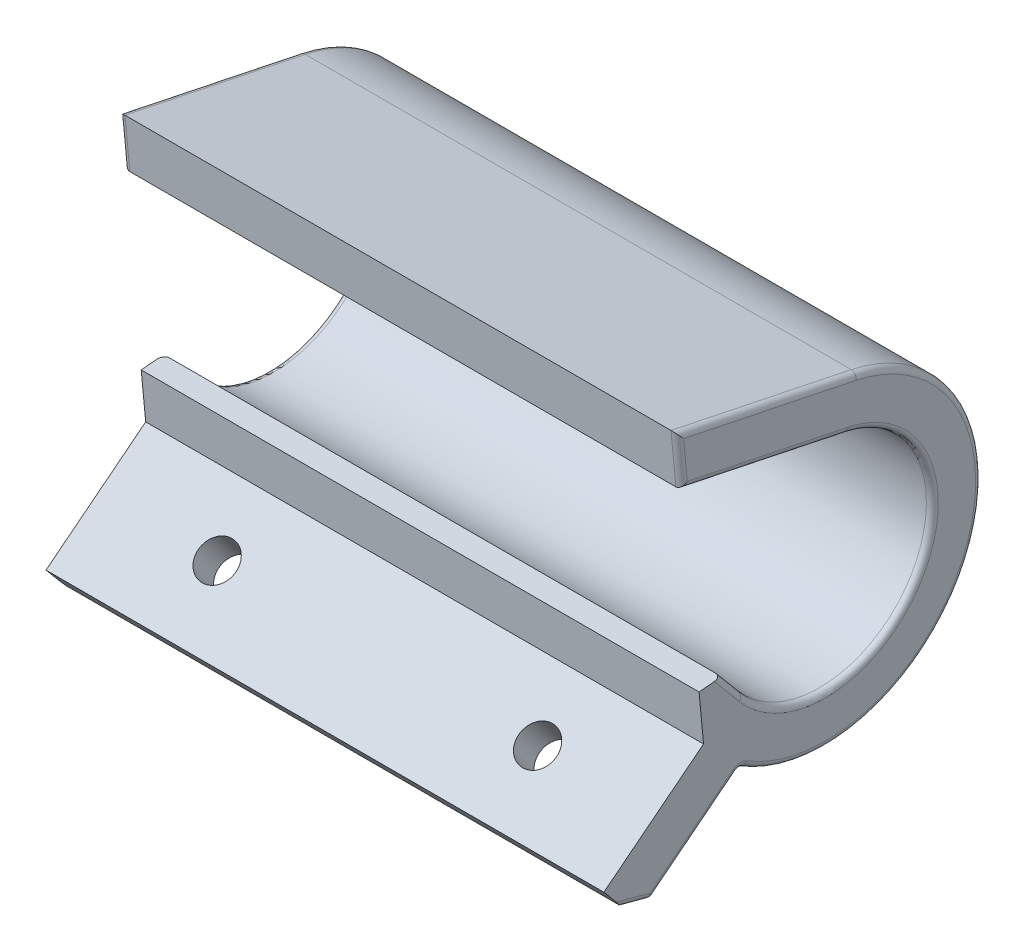
from build123d import *

# Parameters (mm, degrees)
BOSS_EXTRU_1_DEPTH      = 23.5
BOSS_EXTRU_1_DEPTH_BACK = 23.5
CONG_1_R                = 0.5


with BuildPart() as part:
    # Esquisse1 → Boss.-Extru.1 (new, two sides: drawn at the far end of the back side and taken through both)
    with BuildSketch(Plane.ZY.offset(-BOSS_EXTRU_1_DEPTH_BACK)):
        with BuildLine():
            Line((-3.091898803, -3.292916778), (4.377181629, -9.176129997))
            Line((4.377181629, -9.176129997), (6.792591777, -8.531309234))
            Line((6.792591777, -8.531309234), (8.398220531, -6.615074305))
            Line((8.398220531, -6.615074305), (0, 0))
            Line((0, 0), (0.37642312, 3.982248816))
            Line((0.37642312, 3.982248816), (-1.512852543, 4.160833097))
            Line((-1.512852543, 4.160833097), (-3.375381898, 1.938000579))
            ThreePointArc((-3.375381898, 1.938000579), (-17.997095622, 3.097535614), (-12.105520327, 16.529898559))
            Line((-12.105520327, 16.529898559), (1.836440879, 19.428042878))
            Line((1.836440879, 19.428042878), (2.244776367, 23.747898452))
            Line((2.244776367, 23.747898452), (-12.949388907, 20.589455882))
            ThreePointArc((-12.949388907, 20.589455882), (-22.425731532, 2.702545011), (-3.091898803, -3.292916778))
        make_face()
    extrude(amount=BOSS_EXTRU_1_DEPTH + BOSS_EXTRU_1_DEPTH_BACK)

    # Esquisse2 → Fraisage pour vis à tête fraisée M31 (revolve, cut)
    with BuildSketch(Plane(origin=(-13.5, -6.669151695, 1.19442726), x_dir=(0, 0.6187737902502314, -0.7855692181465379), z_dir=(1, 0, 0))):
        Polygon((0, 0), (0, 10.96137699), (1.6, 10), (1.6, 1.7), (2.9, 0.4), (2.9, 0), align=None)
    fraisage_pour_vis_t_te_frais_e_m31 = revolve(axis=Axis((-13.5, -11.657516231, -2.734786308), (0, 0.7855692181465378, 0.6187737902502314)), mode=Mode.SUBTRACT)

    # Symétrie1: Fraisage pour vis à tête fraisée M31 across plane
    add(fraisage_pour_vis_t_te_frais_e_m31.mirror(Plane(origin=(0, 0, 0), x_dir=(0, 0, 1), z_dir=(1, 0, 0))), mode=Mode.SUBTRACT)

    # Congé1
    cong_1_edges = [part.edges().sort_by_distance(p)[0] for p in [
        (-23.5, 22.168677167, -5.35230627),
        (0, -8.531309234, 6.792591777),
        (0, -9.176129997, 4.377181629),
        (0, -3.292916778, -3.091898803),
        (-23.5, 21.587970665, 2.040608623),
        (-23.5, 17.978970719, -5.134539724),
        (-23.5, 3.097535614, -17.997095622),
        (-23.5, 3.049416838, -2.44411722),
        (-23.5, -8.853719615, 5.584886703),
        (-23.5, -6.234523387, 0.642641413),
        (-23.5, 2.702545011, -22.425731532),
        (23.5, 2.702545011, -22.425731532),
        (23.5, 22.168677167, -5.35230627),
        (23.5, 21.587970665, 2.040608623),
        (23.5, 17.978970719, -5.134539724),
        (23.5, 3.097535614, -17.997095622),
        (23.5, 3.049416838, -2.44411722),
        (23.5, -8.853719615, 5.584886703),
        (23.5, -6.234523387, 0.642641413),
    ]]
    fillet(cong_1_edges, radius=CONG_1_R)


solid = part.part
